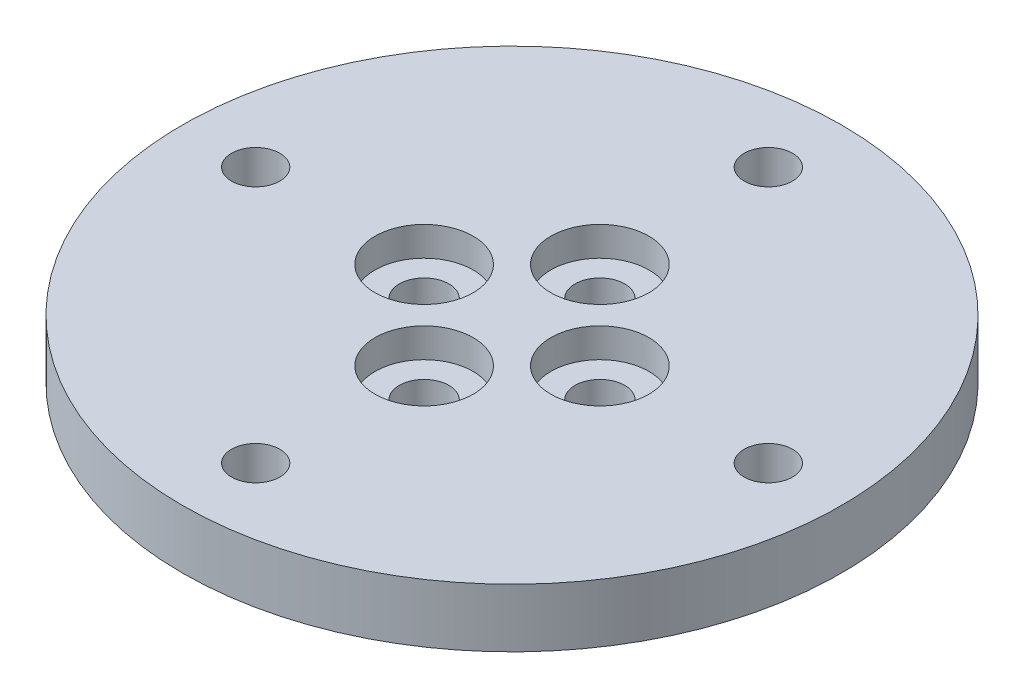
from build123d import *

# Parameters (mm, degrees)
SKETCH_1_R                  = 22.5
EXTRUDE_1_DEPTH             = 4
HOLE_WIZARD_M31_D           = 3.4
HOLE_WIZARD_M31_CBORE_D     = 6.7
HOLE_WIZARD_M31_CBORE_DEPTH = 2
M4X0_71_D                   = 3.3


with BuildPart() as part:
    # Эскиз1 → Бобышка-Вытянуть1 (new body)
    with BuildSketch(Plane(origin=(0, 0, 0), x_dir=(1, 0, 0), z_dir=(0, 1, 0))):
        with Locations(Location((0, 0, 0), (0, 0, 270))):
            Circle(SKETCH_1_R)
    extrude(amount=EXTRUDE_1_DEPTH)

    # Цековка для  винта с полукруглой головкой M31 (through all)
    with Locations(Plane(origin=(0, 4, 0), x_dir=(1, 0, 0), z_dir=(0, 1, 0))):
        with Locations((0, 6), (-6, 0), (0, -6), (6, 0)):
            CounterBoreHole(HOLE_WIZARD_M31_D / 2, HOLE_WIZARD_M31_CBORE_D / 2, HOLE_WIZARD_M31_CBORE_DEPTH)

    # Отверстие обработанное метчиком M4x0.71 (through all)
    with Locations(Plane(origin=(0, 4, 0), x_dir=(1, 0, 0), z_dir=(0, 1, 0))):
        with Locations((-17.5, 0), (0, -17.5), (17.5, 0), (0, 17.5)):
            Hole(M4X0_71_D / 2)


solid = part.part
